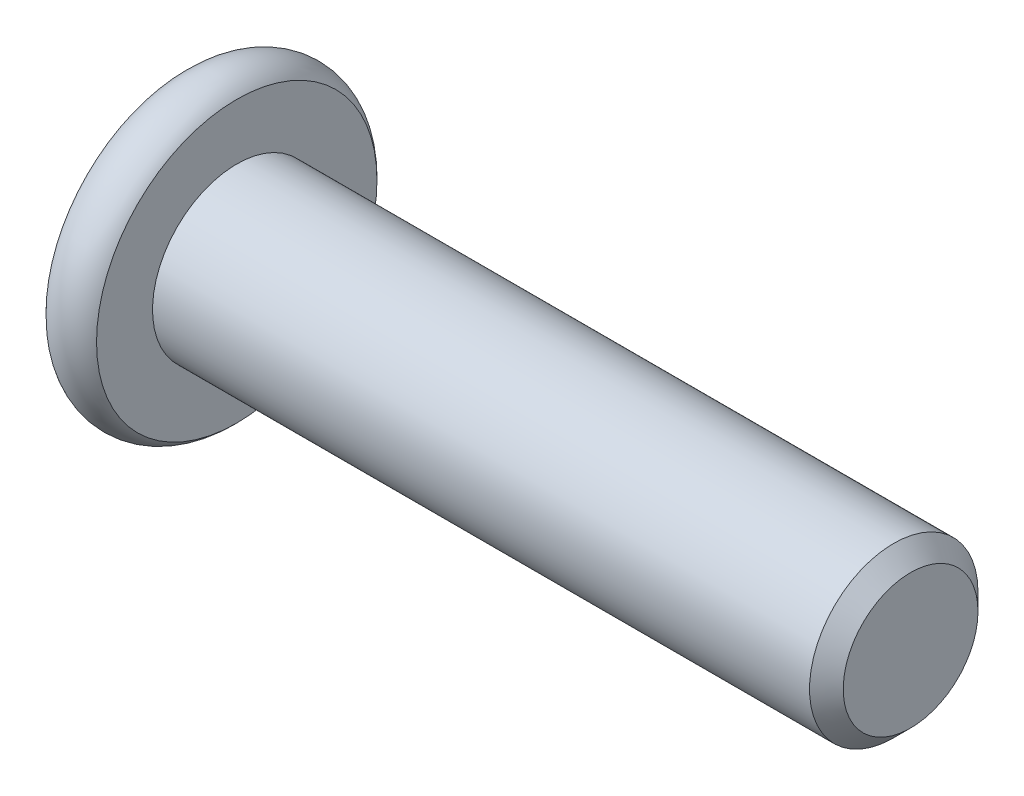
from build123d import *

# Parameters (mm, degrees)
SKETCH2_R           = 2.5
BOSS_EXTRUDE1_DEPTH = 20
CHAMFER1_SIZE       = 0.5
CUT_EXTRUDE1_DEPTH  = 2.3
SKETCH8_R           = 1.782050808
CUT_EXTRUDE2_DEPTH  = 1
CUT_EXTRUDE2_DRAFT  = -45


with BuildPart() as part:
    # Sketch2 → Boss-Extrude1 (new body)
    with BuildSketch(Plane(origin=(0, 0, 0), x_dir=(0, 0, -1), z_dir=(1, 0, 0))):
        Circle(SKETCH2_R)
    extrude(amount=-BOSS_EXTRUDE1_DEPTH)

    # Chamfer1
    chamfer1_edges = [part.edges().sort_by_distance(p)[0] for p in [
        (0, 0, 2.5),
    ]]
    chamfer(chamfer1_edges, length=CHAMFER1_SIZE)

    # Sketch6 → Revolve1 (revolve)
    with BuildSketch(Plane.XY, mode=Mode.PRIVATE) as revolve1_sk:
        with BuildLine():
            Line((-21.5, 0), (-21.5, 4.161437828))
            ThreePointArc((-21.5, 4.161437828), (-20.75, 4.5), (-20, 4.161437828))
            Line((-20, 4.161437828), (-20, 0))
            Line((-20, 0), (-21.5, 0))
        make_face()
    revolve(revolve1_sk.sketch.rotate(Axis((-20, 0, 0), (1, 0, 0)), 180), axis=Axis((-20, 0, 0), (1, 0, 0)))

    # Sketch7 → Cut-Extrude1 (cut)
    with BuildSketch(Plane.ZY.offset(21.5)):
        Polygon((0, 1.732050808), (-1.5, 0.866025404), (-1.5, -0.866025404), (0, -1.732050808), (1.5, -0.866025404), (1.5, 0.866025404), align=None)
    extrude(amount=-CUT_EXTRUDE1_DEPTH, mode=Mode.SUBTRACT)


with BuildPart() as cut_extrude2_tool:
    # Sketch8 → Cut-Extrude2 (with draft: the straight prism first)
    with BuildSketch(Plane.ZY.offset(21.5)):
        Circle(SKETCH8_R)
    extrude(amount=-CUT_EXTRUDE2_DEPTH)
    # Cut-Extrude2: the draft: its side faces are tilted about the plane it starts from
    cut_extrude2_sides = [cut_extrude2_tool.faces().sort_by_distance(p)[0] for p in [
        (-21, 0, -1.782050808),
    ]]
    draft(cut_extrude2_sides, Plane.ZY.offset(21.5), CUT_EXTRUDE2_DRAFT)


with BuildPart() as part_1:
    add(part.part)

    # Cut-Extrude2: cut by cut_extrude2_tool
    add(cut_extrude2_tool.part, mode=Mode.SUBTRACT)


solid = part_1.part
